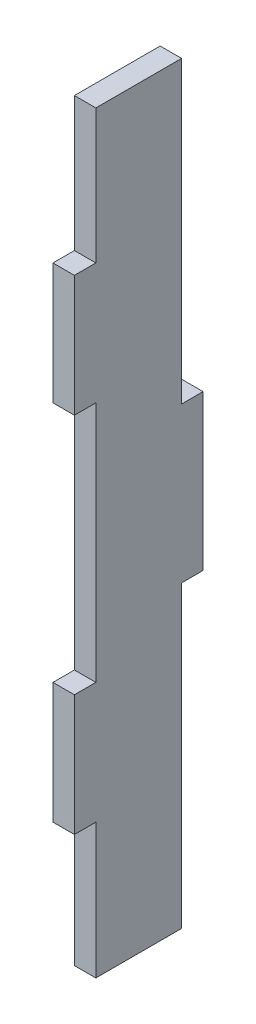
from build123d import *

# Parameters (mm, degrees)
SKETCH1_W           = 18
SKETCH1_H           = 105.4
BOSS_EXTRUDE1_DEPTH = 3
SKETCH3_W           = 3
SKETCH3_H           = 41.865
CUT_EXTRUDE2_DEPTH  = 3
SKETCH5_W           = 3
SKETCH5_H           = 18.88
SKETCH5_H_2         = 33.86
SKETCH5_H_3         = 18.78
CUT_EXTRUDE5_DEPTH  = 3


with BuildPart() as part:
    # Sketch1 → Boss-Extrude1 (new body)
    with BuildSketch(Plane(origin=(0, 0, 0), x_dir=(0, 0, -1), z_dir=(1, 0, 0))):
        Rectangle(SKETCH1_W, SKETCH1_H)
    extrude(amount=BOSS_EXTRUDE1_DEPTH)

    # Sketch3 → Cut-Extrude2 (cut)
    with BuildSketch(Plane(origin=(3, 0, 0), x_dir=(0, 0, -1), z_dir=(1, 0, 0))):
        with Locations((7.5, -31.7675)):
            Rectangle(SKETCH3_W, SKETCH3_H)
        with Locations((7.5, 31.7675)):
            Rectangle(SKETCH3_W, SKETCH3_H)
    extrude(amount=-CUT_EXTRUDE2_DEPTH, mode=Mode.SUBTRACT)

    # Sketch5 → Cut-Extrude5 (cut)
    with BuildSketch(Plane.ZY):
        with Locations((7.5, -43.26)):
            Rectangle(SKETCH5_W, SKETCH5_H)
        with Locations((7.5, 0.04)):
            Rectangle(SKETCH5_W, SKETCH5_H_2)
        with Locations((7.5, 43.31)):
            Rectangle(SKETCH5_W, SKETCH5_H_3)
    extrude(amount=-CUT_EXTRUDE5_DEPTH, mode=Mode.SUBTRACT)


solid = part.part
